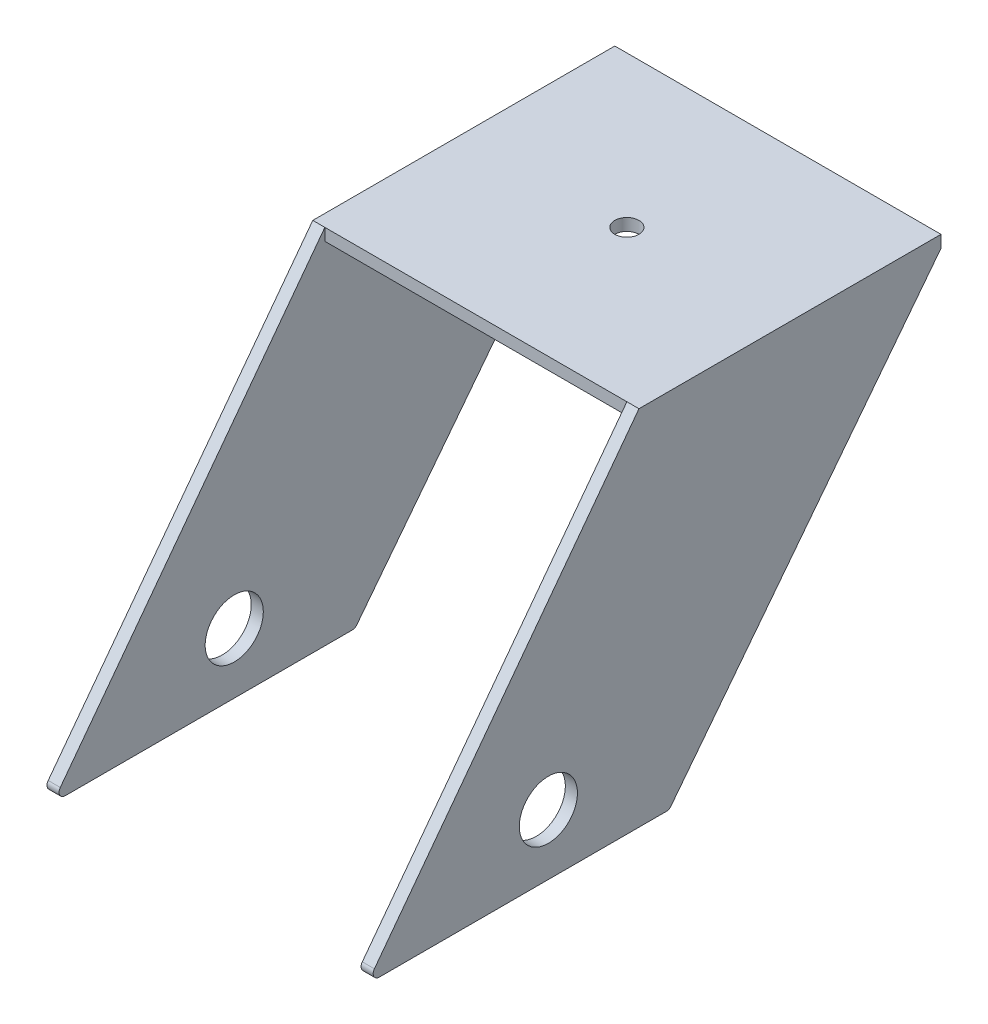
from build123d import *

# Parameters (mm, degrees)
SKETCH2_W           = 50
SKETCH2_H           = 50
SKETCH2_R           = 2
BOSS_EXTRUDE1_DEPTH = 2
SKETCH4_R           = 4.812837504
BOSS_EXTRUDE2_DEPTH = 2
BOSS_EXTRUDE3_START = 2
SKETCH3_R           = 4.812837504
BOSS_EXTRUDE3_DEPTH = 2
FILLET1_R           = 1
FILLET2_R           = 1


with BuildPart() as part:
    # Sketch2 → Boss-Extrude1 (new body)
    with BuildSketch(Plane(origin=(0, 0, 0), x_dir=(1, 0, 0), z_dir=(0, 1, 0))):
        Rectangle(SKETCH2_W, SKETCH2_H)
        with Locations(Location((0, 0, 0), (0, 0, 270))):
            Circle(SKETCH2_R, mode=Mode.SUBTRACT)
    extrude(amount=BOSS_EXTRUDE1_DEPTH)

    # Sketch4 → Boss-Extrude2 (add)
    with BuildSketch(Plane.ZY.offset(25)):
        Polygon((25, 2), (-25, 2), (-25, 0.026324244), (20, -58), (70, -58), align=None)
        with Locations(Location((40, -48, 0), (0, 0, 180))):
            Circle(SKETCH4_R, mode=Mode.SUBTRACT)
    extrude(amount=BOSS_EXTRUDE2_DEPTH)

    # Sketch3 → Boss-Extrude3 (add)
    with BuildSketch(Plane(origin=(25, 0, 0), x_dir=(0, 0, -1), z_dir=(1, 0, 0)).offset(BOSS_EXTRUDE3_START)):
        Polygon((-25, 2), (-70, -58), (-20, -58), (25, 0), (25, 2), align=None)
        with Locations((-40, -48)):
            Circle(SKETCH3_R, mode=Mode.SUBTRACT)
    extrude(amount=-BOSS_EXTRUDE3_DEPTH)

    # Fillet1
    fillet1_edges = [part.edges().sort_by_distance(p)[0] for p in [
        (-26, -58, 20),
        (26, -58, 20),
    ]]
    fillet(fillet1_edges, radius=FILLET1_R)

    # Fillet2
    fillet2_edges = [part.edges().sort_by_distance(p)[0] for p in [
        (-26, -58, 70),
        (26, -58, 70),
    ]]
    fillet(fillet2_edges, radius=FILLET2_R)


solid = part.part
